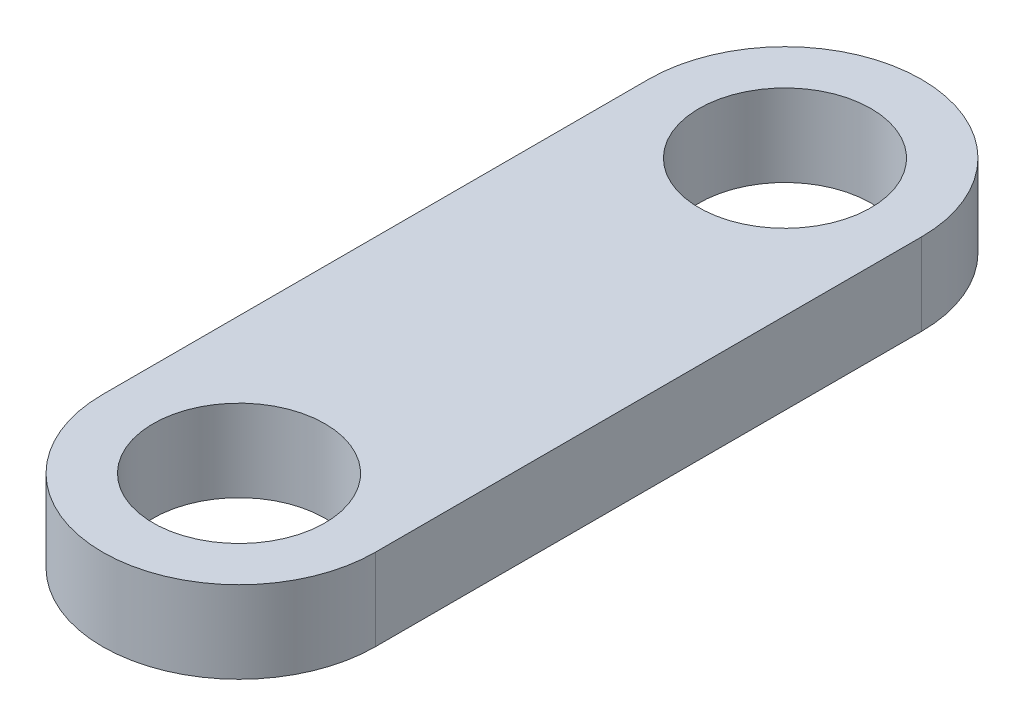
from build123d import *

# Parameters (mm, degrees)
SKETCH2_R           = 2
BOSS_EXTRUDE1_DEPTH = 1.905


with BuildPart() as part:
    # Sketch2 → Boss-Extrude1 (new body)
    with BuildSketch(Plane(origin=(0, 0, 0), x_dir=(1, 0, 0), z_dir=(0, 1, 0))):
        with BuildLine():
            Line((3.175, 0), (3.175, -12.7))
            ThreePointArc((3.175, -12.7), (0, -15.875), (-3.175, -12.7))
            Line((-3.175, -12.7), (-3.175, 0))
            ThreePointArc((-3.175, 0), (0, 3.175), (3.175, 0))
        make_face()
        with Locations(Location((0, 0, 0), (0, 0, 90))):
            Circle(SKETCH2_R, mode=Mode.SUBTRACT)
        with Locations(Location((0, -12.7, 0), (0, 0, 90))):
            Circle(SKETCH2_R, mode=Mode.SUBTRACT)
    extrude(amount=BOSS_EXTRUDE1_DEPTH)


solid = part.part
